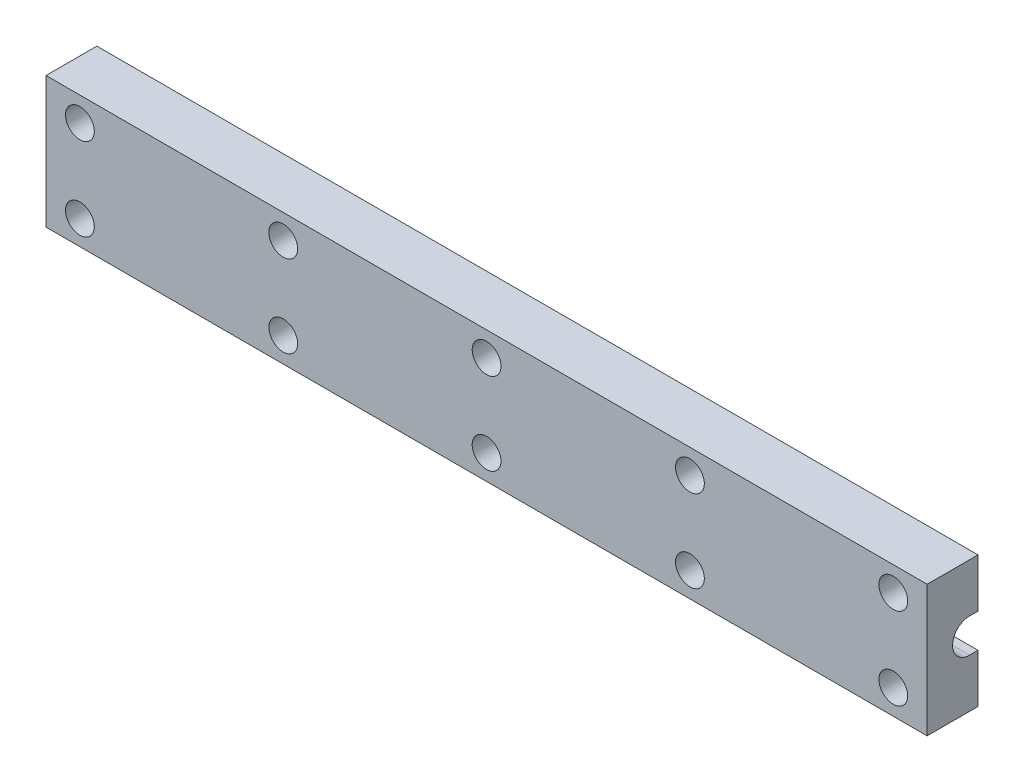
from build123d import *

# Parameters (mm, degrees)
BOSS_EXTRUDE1_DEPTH      = 60
BOSS_EXTRUDE1_DEPTH_BACK = 20
SKETCH2_R                = 1.7
CUT_EXTRUDE1_DEPTH       = 10
BOSS_EXTRUDE2_START      = 24
BOSS_EXTRUDE2_DEPTH      = 24
CUT_EXTRUDE2_START       = -10
SKETCH4_R                = 1.7
CUT_EXTRUDE2_DEPTH       = 10


with BuildPart() as part:
    # Sketch1 → Boss-Extrude1 (new, two sides: drawn at the far end of the back side and taken through both)
    with BuildSketch(Plane(origin=(190.645148, 0, 0), x_dir=(0, 0, -1), z_dir=(1, 0, 0)).offset(-BOSS_EXTRUDE1_DEPTH_BACK)):
        with BuildLine():
            Line((-240.970904961, 189.163538159), (-246.970904961, 189.163538159))
            Line((-246.970904961, 189.163538159), (-246.970904961, 173.663538158))
            Line((-246.970904961, 173.663538158), (-240.970904961, 173.663538158))
            Line((-240.970904961, 173.663538158), (-240.970904961, 179.413538158))
            Line((-240.970904961, 179.413538158), (-241.970904961, 179.413538158))
            ThreePointArc((-241.970904961, 179.413538158), (-243.970904961, 181.413538158), (-241.970904961, 183.413538158))
            Line((-241.970904961, 183.413538158), (-240.970904961, 183.413538158))
            Line((-240.970904961, 183.413538158), (-240.970904961, 189.163538159))
        make_face()
    extrude(amount=BOSS_EXTRUDE1_DEPTH + BOSS_EXTRUDE1_DEPTH_BACK)

    # Sketch2 → Cut-Extrude1 (cut)
    with BuildSketch(Plane.XY.offset(246.970904961)):
        with Locations((246.645148, 186.288538158)):
            Circle(SKETCH2_R)
        with Locations((222.645148, 186.288538158)):
            Circle(SKETCH2_R)
        with Locations((198.645148, 186.288538158)):
            Circle(SKETCH2_R)
        with Locations((174.645148, 186.288538158)):
            Circle(SKETCH2_R)
        with Locations((246.645148, 176.593153442)):
            Circle(SKETCH2_R)
        with Locations((222.645148, 176.593153442)):
            Circle(SKETCH2_R)
        with Locations((198.645148, 176.593153442)):
            Circle(SKETCH2_R)
        with Locations((174.645148, 176.593153442)):
            Circle(SKETCH2_R)
    extrude(amount=-CUT_EXTRUDE1_DEPTH, mode=Mode.SUBTRACT)

    # Sketch3 → Boss-Extrude2 (add)
    with BuildSketch(Plane.ZY.offset(-170.645148).offset(BOSS_EXTRUDE2_START)):
        with BuildLine():
            Line((241.970904961, 179.413538158), (240.970904961, 179.413538158))
            Line((240.970904961, 179.413538158), (240.970904961, 173.663538158))
            Line((240.970904961, 173.663538158), (246.970904961, 173.663538158))
            Line((246.970904961, 173.663538158), (246.970904961, 189.163538159))
            Line((246.970904961, 189.163538159), (240.970904961, 189.163538159))
            Line((240.970904961, 189.163538159), (240.970904961, 183.413538158))
            Line((240.970904961, 183.413538158), (241.970904961, 183.413538158))
            ThreePointArc((241.970904961, 183.413538158), (243.970904961, 181.413538158), (241.970904961, 179.413538158))
        make_face()
    extrude(amount=-BOSS_EXTRUDE2_DEPTH)

    # Sketch4 → Cut-Extrude2 (cut)
    with BuildSketch(Plane(origin=(0, 0, 240.970904961), x_dir=(-1, 0, 0), z_dir=(0, 0, -1)).offset(CUT_EXTRUDE2_START)):
        with Locations(Location((-174.645148, 176.593153442, 0), (0, 0, 180))):
            Circle(SKETCH4_R)
        with Locations(Location((-174.645148, 186.288538158, 0), (0, 0, 180))):
            Circle(SKETCH4_R)
        with Locations((-150.645148, 186.288538158)):
            Circle(SKETCH4_R)
        with Locations((-150.645148, 176.538538158)):
            Circle(SKETCH4_R)
    extrude(amount=CUT_EXTRUDE2_DEPTH, mode=Mode.SUBTRACT)


solid = part.part
